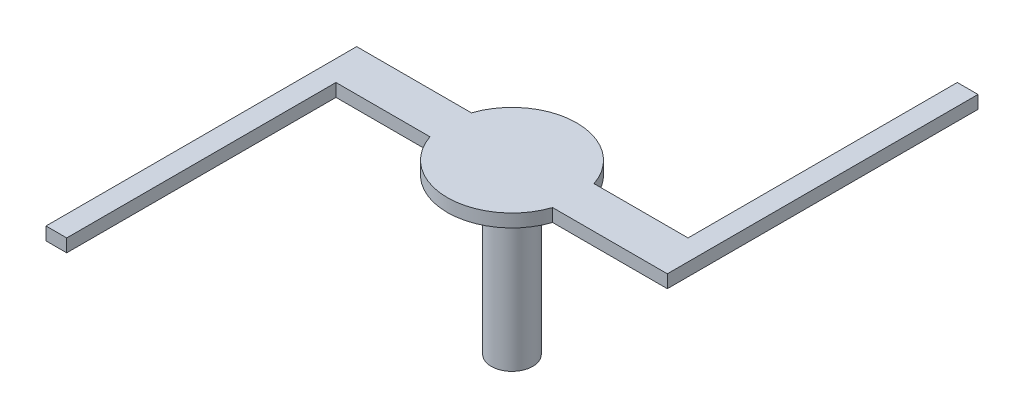
from build123d import *

# Parameters (mm, degrees)
SKETCH_1_R      = 4
EXTRUDE_1_DEPTH = 30
EXTRUDE_2_DEPTH = 2.5


with BuildPart() as part:
    # Эскиз1 → Бобышка-Вытянуть1 (new body)
    with BuildSketch(Plane(origin=(0, 0, 0), x_dir=(1, 0, 0), z_dir=(0, 1, 0))):
        with Locations(Location((0, 0, 0), (0, 0, 270))):
            Circle(SKETCH_1_R)
    extrude(amount=EXTRUDE_1_DEPTH)

    # Эскиз2 → Бобышка-Вытянуть2 (add)
    with BuildSketch(Plane(origin=(0, 30, 0), x_dir=(1, 0, 0), z_dir=(0, 1, 0))):
        with BuildLine():
            Line((30, 4), (30, 56))
            Line((30, 56), (34, 56))
            Line((34, 56), (34, -4))
            Line((34, -4), (11.842719282, -4))
            ThreePointArc((11.842719282, -4), (0, -12.5), (-11.842719282, -4))
            Line((-11.842719282, -4), (-30, -4))
            Line((-30, -4), (-30, -56))
            Line((-30, -56), (-34, -56))
            Line((-34, -56), (-34, 4))
            Line((-34, 4), (-11.842719282, 4))
            ThreePointArc((-11.842719282, 4), (0, 12.5), (11.842719282, 4))
            Line((11.842719282, 4), (30, 4))
        make_face()
    extrude(amount=EXTRUDE_2_DEPTH)


solid = part.part
